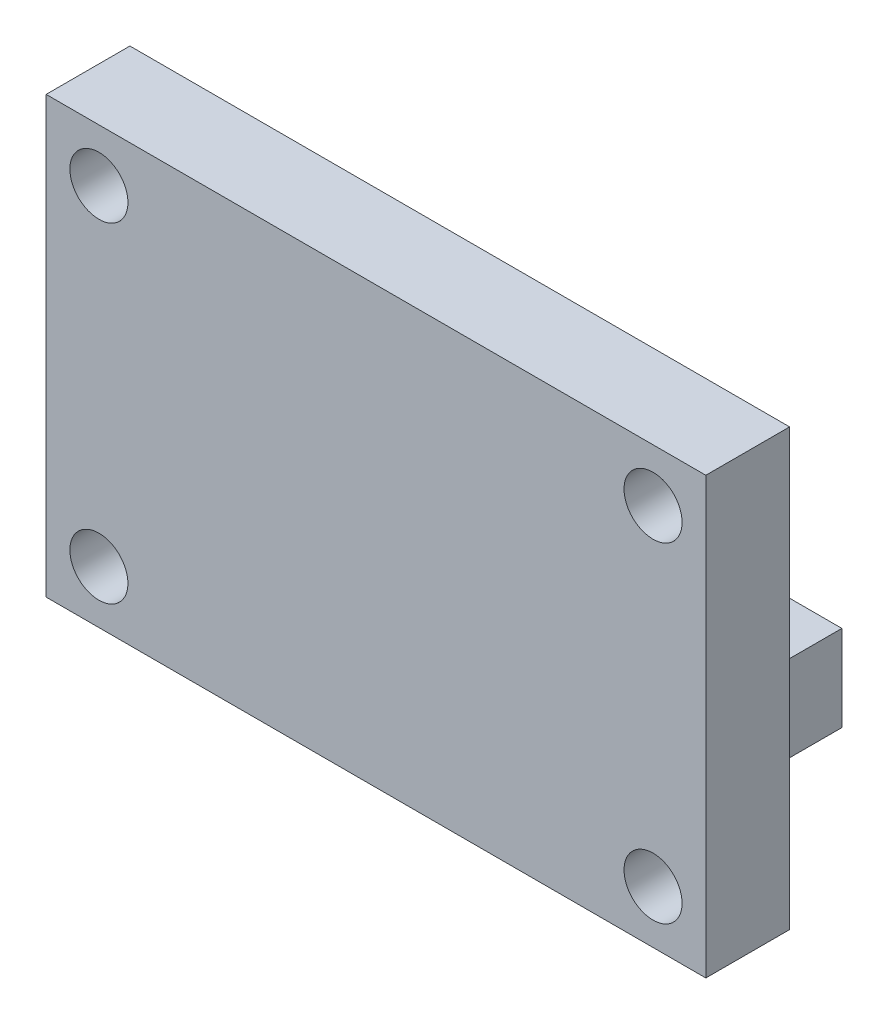
from build123d import *

# Parameters (mm, degrees)
SKETCH1_W           = 25
SKETCH1_H           = 16.5
SKETCH1_R           = 1.1
BOSS_EXTRUDE3_DEPTH = 3.175
SKETCH4_W           = 14.012619733
SKETCH4_H           = 3.256845332
BOSS_EXTRUDE4_DEPTH = 7.62
RIB13_REACH         = 22.577
SKETCH8_WALL_W      = 52.139653992
SKETCH8_WALL_H      = 2.54
SKETCH11_R          = 1.1
CUT_EXTRUDE3_DEPTH  = 22.341270784


with BuildPart() as part:
    # Sketch1 → Boss-Extrude3 (new body)
    with BuildSketch(Plane.XY):
        with Locations((0.288145608, 3.722304951)):
            Rectangle(SKETCH1_W, SKETCH1_H)
        with Locations((-10.211854392, 9.972304951)):
            Circle(SKETCH1_R, mode=Mode.SUBTRACT)
        with Locations((-10.211854392, -2.527695049)):
            Circle(SKETCH1_R, mode=Mode.SUBTRACT)
        with Locations((10.788145608, 9.972304951)):
            Circle(SKETCH1_R, mode=Mode.SUBTRACT)
        with Locations((10.788145608, -2.527695049)):
            Circle(SKETCH1_R, mode=Mode.SUBTRACT)
    extrude(amount=-BOSS_EXTRUDE3_DEPTH)

    # Sketch4 → Boss-Extrude4 (add)
    with BuildSketch(Plane(origin=(0, 0, -3.175), x_dir=(-1, 0, 0), z_dir=(0, 0, -1))):
        with Locations((-0.142456745, -2.899272383)):
            Rectangle(SKETCH4_W, SKETCH4_H)
    extrude(amount=BOSS_EXTRUDE4_DEPTH)

    # Sketch8 wall → Rib13 (add, up to next)
    with BuildSketch(Plane(origin=(0, 2.497441859, -5.961770268), x_dir=(0, -0.784409210178, -0.620243654533), z_dir=(0, 0.620243654533, -0.784409210178)), mode=Mode.PRIVATE) as rib13_sk1:
        Rectangle(SKETCH8_WALL_W, SKETCH8_WALL_H)
    rib13_tool1 = extrude(rib13_sk1.sketch, amount=-RIB13_REACH, mode=Mode.PRIVATE) - part.part
    add(rib13_tool1.solids().sort_by_distance((0, 2.497441859, -5.961770268))[0])

    # Sketch11 → Cut-Extrude3 (cut, through all)
    with BuildSketch(Plane(origin=(0, -1.270849717, 0), x_dir=(1, 0, 0), z_dir=(0, 1, 0))):
        with Locations(Location((-4.863853122, 8.795, 0), (0, 0, 270))):
            Circle(SKETCH11_R)
        with Locations(Location((5.148766611, 8.795, 0), (0, 0, 270))):
            Circle(SKETCH11_R)
    extrude(amount=-CUT_EXTRUDE3_DEPTH, mode=Mode.SUBTRACT)


solid = part.part
